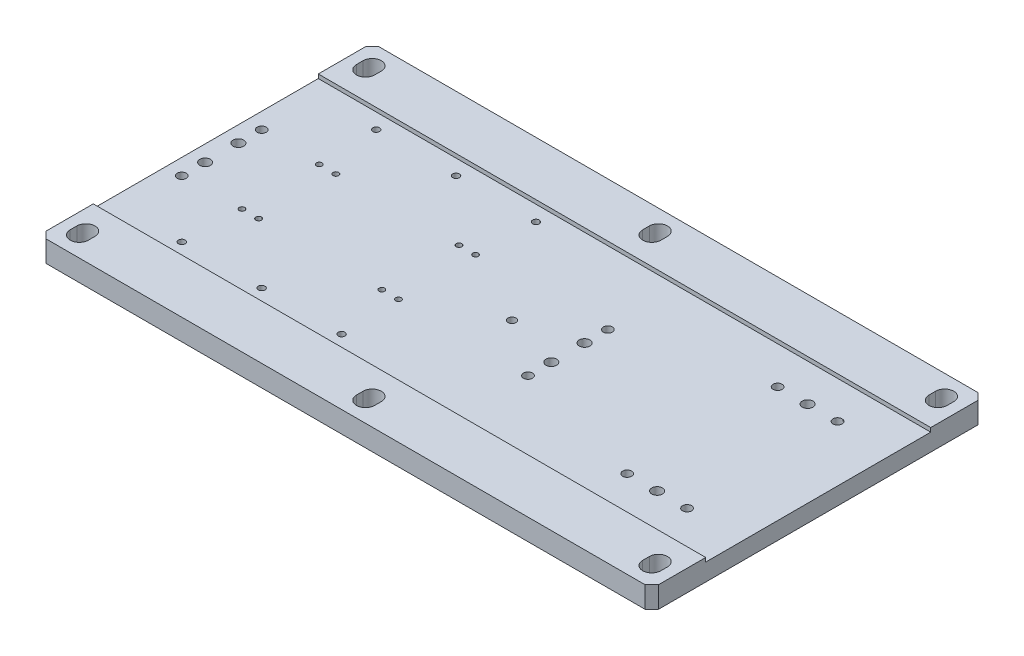
from build123d import *

# Parameters (mm, degrees)
SKETCH1_W                = 460
SKETCH1_H                = 250
BOSS_EXTRUDE1_DEPTH      = 16
SKETCH2_W                = 460
SKETCH2_H                = 169
CUT_EXTRUDE1_DEPTH       = 3
F_6_0_6_DIAMETER_HOLE1_D = 6
F_8_0MM_DOWEL_HOLE1_D    = 8
M8_TAPPED_HOLE1_D        = 6.8
M6_TAPPED_HOLE1_D        = 5
M5_TAPPED_HOLE1_D        = 4.2
CUT_EXTRUDE2_DEPTH       = 263.261320061
CHAMFER1_SIZE            = 5


with BuildPart() as part:
    # Sketch1 → Boss-Extrude1 (new body)
    with BuildSketch(Plane(origin=(0, 0, 0), x_dir=(1, 0, 0), z_dir=(0, 1, 0))):
        Rectangle(SKETCH1_W, SKETCH1_H)
    extrude(amount=BOSS_EXTRUDE1_DEPTH)

    # Sketch2 → Cut-Extrude1 (cut)
    with BuildSketch(Plane(origin=(0, 16, 0), x_dir=(1, 0, 0), z_dir=(0, 1, 0))):
        Rectangle(SKETCH2_W, SKETCH2_H)
    extrude(amount=-CUT_EXTRUDE1_DEPTH, mode=Mode.SUBTRACT)

    # Ø6.0 (6) Diameter Hole1 (through all)
    with Locations(Plane(origin=(0, 13, 0), x_dir=(1, 0, 0), z_dir=(0, 1, 0))):
        with Locations((0, 0)):
            Hole(F_6_0_6_DIAMETER_HOLE1_D / 2)

    # Ø8.0mm Dowel Hole1 (through all)
    with Locations(Plane(origin=(0, 13, 0), x_dir=(1, 0, 0), z_dir=(0, 1, 0))):
        with Locations((42, 12.5), (42, -12.5), (165.5, 56.5), (165.5, -56.5), (-218, 12.5), (-218, -12.5)):
            Hole(F_8_0MM_DOWEL_HOLE1_D / 2)

    # M8 Tapped Hole1 (through all)
    with Locations(Plane(origin=(0, 13, 0), x_dir=(1, 0, 0), z_dir=(0, 1, 0))):
        with Locations((42, 30), (42, -30), (143, 56.5), (188, 56.5), (188, -56.5), (143, -56.5), (-218, 30), (-218, -30)):
            Hole(M8_TAPPED_HOLE1_D / 2)

    # M6 Tapped Hole1 (through all)
    with Locations(Plane(origin=(0, 13, 0), x_dir=(1, 0, 0), z_dir=(0, 1, 0))):
        with Locations((-175, 73), (-115, 73), (-55, 73), (-175, -73), (-115, -73), (-55, -73)):
            Hole(M6_TAPPED_HOLE1_D / 2)

    # M5 Tapped Hole1 (through all)
    with Locations(Plane(origin=(0, 13, 0), x_dir=(1, 0, 0), z_dir=(0, 1, 0))):
        with Locations((-56.3, 29), (-56.3, -29), (-68.8, 29), (-68.8, -29), (-173.8, 29), (-173.8, -29), (-161.3, 29), (-161.3, -29)):
            Hole(M5_TAPPED_HOLE1_D / 2)

    # Sketch13 → Cut-Extrude2 (cut, through all)
    with BuildSketch(Plane(origin=(0, 16, 0), x_dir=(1, 0, 0), z_dir=(0, 1, 0))):
        with BuildLine():
            Line((-221.8, 105), (-221.8, 110))
            ThreePointArc((-221.8, 110), (-215, 116.8), (-208.2, 110))
            Line((-208.2, 110), (-208.2, 105))
            ThreePointArc((-208.2, 105), (-215, 98.2), (-221.8, 105))
        make_face()
        with BuildLine():
            Line((-6.8, 105), (-6.8, 110))
            ThreePointArc((-6.8, 110), (0, 116.8), (6.8, 110))
            Line((6.8, 110), (6.8, 105))
            ThreePointArc((6.8, 105), (0, 98.2), (-6.8, 105))
        make_face()
        with BuildLine():
            Line((208.2, 105), (208.2, 110))
            ThreePointArc((208.2, 110), (215, 116.8), (221.8, 110))
            Line((221.8, 110), (221.8, 105))
            ThreePointArc((221.8, 105), (215, 98.2), (208.2, 105))
        make_face()
        with BuildLine():
            Line((221.8, -105), (221.8, -110))
            ThreePointArc((221.8, -110), (215, -116.8), (208.2, -110))
            Line((208.2, -110), (208.2, -105))
            ThreePointArc((208.2, -105), (215, -98.2), (221.8, -105))
        make_face()
        with BuildLine():
            Line((6.8, -105), (6.8, -110))
            ThreePointArc((6.8, -110), (0, -116.8), (-6.8, -110))
            Line((-6.8, -110), (-6.8, -105))
            ThreePointArc((-6.8, -105), (0, -98.2), (6.8, -105))
        make_face()
        with BuildLine():
            Line((-208.2, -105), (-208.2, -110))
            ThreePointArc((-208.2, -110), (-215, -116.8), (-221.8, -110))
            Line((-221.8, -110), (-221.8, -105))
            ThreePointArc((-221.8, -105), (-215, -98.2), (-208.2, -105))
        make_face()
    extrude(amount=-CUT_EXTRUDE2_DEPTH, mode=Mode.SUBTRACT)

    # Chamfer1
    chamfer1_edges = [part.edges().sort_by_distance(p)[0] for p in [
        (230, 8, 125),
        (-230, 8, 125),
        (-230, 8, -125),
        (230, 8, -125),
    ]]
    chamfer(chamfer1_edges, length=CHAMFER1_SIZE)


solid = part.part
